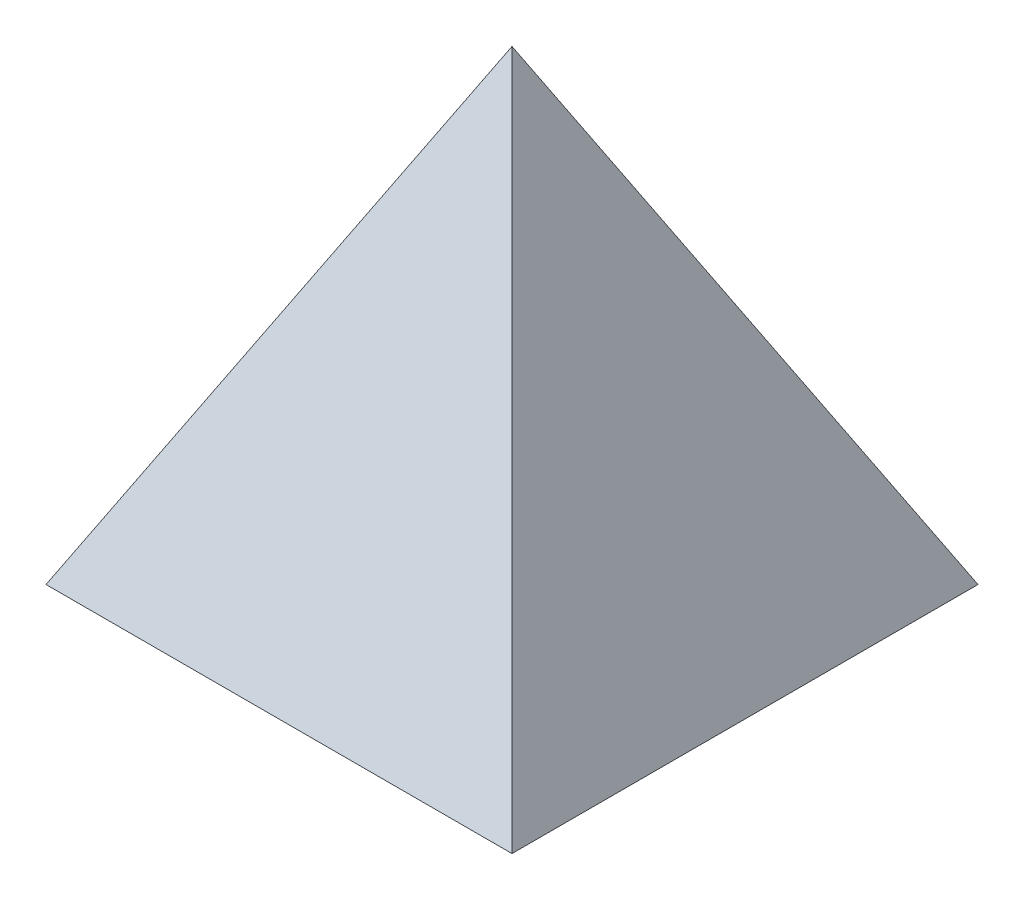
from build123d import *

# Parameters (mm, degrees)
SKETCH1_W           = 50
SKETCH1_H           = 50
BOSS_EXTRUDE1_DEPTH = 50
CUT_EXTRUDE1_DEPTH  = 50
CUT_EXTRUDE2_DEPTH  = 50
CUT_EXTRUDE3_DEPTH  = 50
CUT_EXTRUDE4_DEPTH  = 50


with BuildPart() as part:
    # Sketch1 → Boss-Extrude1 (new body)
    with BuildSketch(Plane(origin=(0, 0, 0), x_dir=(1, 0, 0), z_dir=(0, 1, 0))):
        with Locations((25, 25)):
            Rectangle(SKETCH1_W, SKETCH1_H)
    extrude(amount=BOSS_EXTRUDE1_DEPTH)

    # Sketch2 → Cut-Extrude1 (cut)
    with BuildSketch(Plane.XY):
        Polygon((0, 0), (25, 50), (0, 50), align=None)
    extrude(amount=-CUT_EXTRUDE1_DEPTH, mode=Mode.SUBTRACT)

    # Sketch3 → Cut-Extrude2 (cut)
    with BuildSketch(Plane.XY):
        Polygon((25, 50), (50, 0), (50, 50), align=None)
    extrude(amount=-CUT_EXTRUDE2_DEPTH, mode=Mode.SUBTRACT)

    # Sketch4 → Cut-Extrude3 (cut)
    with BuildSketch(Plane(origin=(0, 0, 0), x_dir=(0, 0, -1), z_dir=(1, 0, 0))):
        Polygon((0, 0), (25, 50), (0, 50), align=None)
    extrude(amount=CUT_EXTRUDE3_DEPTH, mode=Mode.SUBTRACT)

    # Sketch5 → Cut-Extrude4 (cut)
    with BuildSketch(Plane(origin=(0, 0, 0), x_dir=(0, 0, -1), z_dir=(1, 0, 0))):
        Polygon((25, 50), (50, 0), (50, 50), align=None)
    extrude(amount=CUT_EXTRUDE4_DEPTH, mode=Mode.SUBTRACT)


solid = part.part
